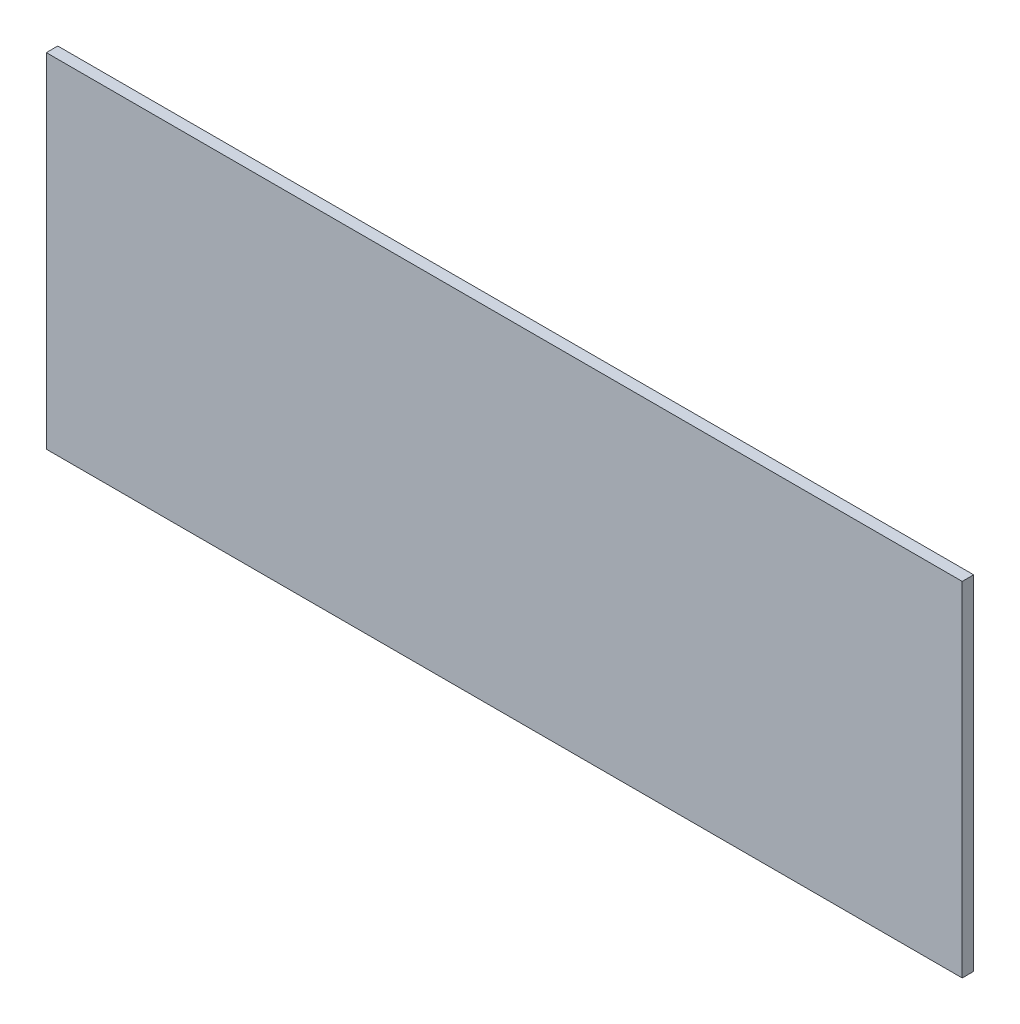
from build123d import *

# Parameters (mm, degrees)
SKETCH1_W           = 4000
SKETCH1_H           = 1500
BOSS_EXTRUDE1_DEPTH = 50


with BuildPart() as part:
    # Sketch1 → Boss-Extrude1 (new body)
    with BuildSketch(Plane.XY):
        Rectangle(SKETCH1_W, SKETCH1_H)
    extrude(amount=BOSS_EXTRUDE1_DEPTH)


solid = part.part
